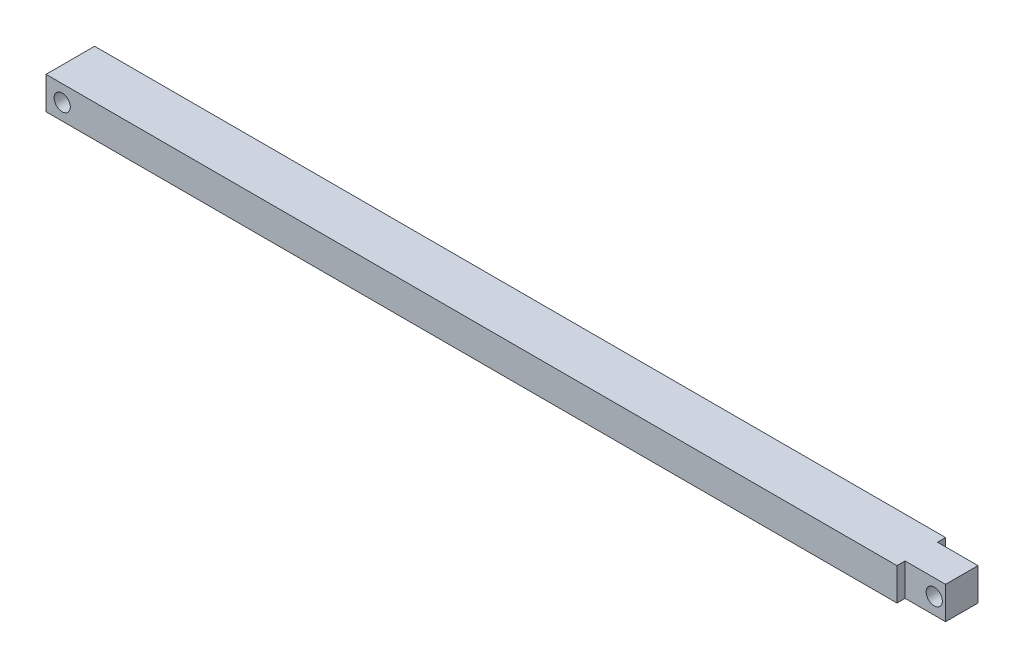
from build123d import *

# Parameters (mm, degrees)
SKETCH1_W           = 550
SKETCH1_H           = 20
SKETCH1_R           = 5
BOSS_EXTRUDE1_DEPTH = 30
SKETCH3_W           = 25
SKETCH3_H           = 5
CUT_EXTRUDE2_DEPTH  = 552.180551181


with BuildPart() as part:
    # Sketch1 → Boss-Extrude1 (new body)
    with BuildSketch(Plane.XY):
        with Locations((275, 10)):
            Rectangle(SKETCH1_W, SKETCH1_H)
        with Locations((10, 10)):
            Circle(SKETCH1_R, mode=Mode.SUBTRACT)
        with Locations((543, 10)):
            Circle(SKETCH1_R, mode=Mode.SUBTRACT)
    extrude(amount=-BOSS_EXTRUDE1_DEPTH)

    # Sketch3 → Cut-Extrude2 (cut, through all)
    with BuildSketch(Plane(origin=(0, 20, 0), x_dir=(1, 0, 0), z_dir=(0, 1, 0))):
        with Locations((537.5, 2.5)):
            Rectangle(SKETCH3_W, SKETCH3_H)
        with Locations((537.5, 27.5)):
            Rectangle(SKETCH3_W, SKETCH3_H)
    extrude(amount=-CUT_EXTRUDE2_DEPTH, mode=Mode.SUBTRACT)


solid = part.part
